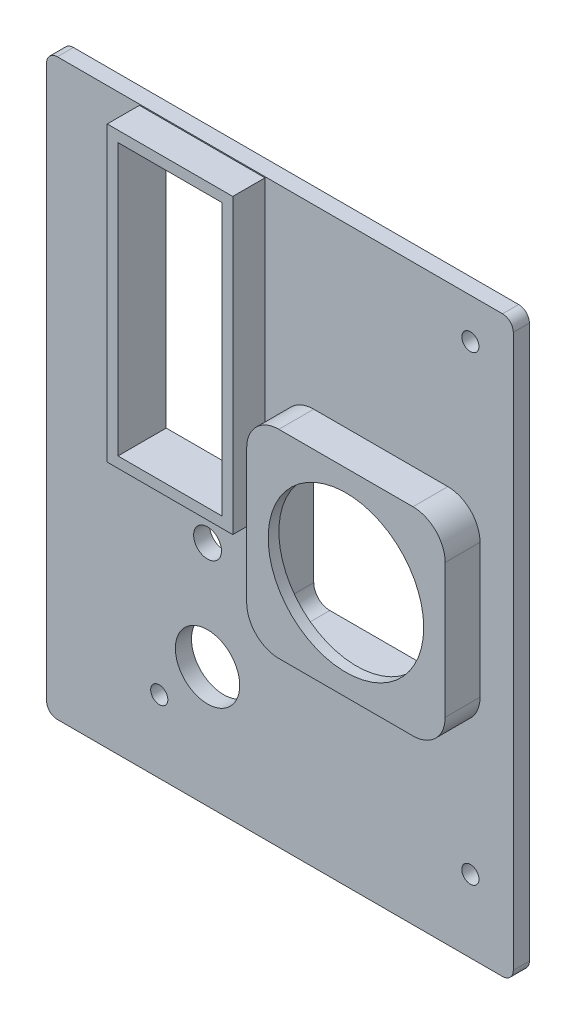
from build123d import *

# Parameters (mm, degrees)
IZIM1_W                 = 87
IZIM1_H                 = 107
TAPA_DEPTH              = 3
REDONDEO1_R             = 2
IZIM3_R                 = 1.6
HUECOSPLACA_DEPTH       = 3
IZIM2_R                 = 1.6
HUECODISIPADOR_DEPTH    = 3
HUECOFAN_DEPTH          = 10
SALIENTE_EXTRUIR4_START = 4.5
SALIENTE_EXTRUIR4_DEPTH = 4.5
SALIENTE_EXTRUIR5_START = -3
CROQUIS8_W              = 37.30700553
CROQUIS8_H              = 38.753013496
SALIENTE_EXTRUIR5_DEPTH = 3
SALIENTE_EXTRUIR6_START = 2
CROQUIS9_R              = 14.5
SALIENTE_EXTRUIR6_DEPTH = 2
CROQUIS10_R             = 2.6
CROQUIS10_R_2           = 6
LEDANDBUZZER_DEPTH      = 10
CROQUIS11_W             = 19.4
CROQUIS11_H             = 50.6
DISPLAY_DEPTH           = 10
CROQUIS12_W             = 23.4
CROQUIS12_H             = 54.6
CROQUIS12_W_2           = 19.4
CROQUIS12_H_2           = 50.6
SALIENTE_EXTRUIR7_DEPTH = 6


with BuildPart() as part:
    # Çizim1 → Tapa (new body)
    with BuildSketch(Plane.XY):
        Rectangle(IZIM1_W, IZIM1_H)
    extrude(amount=TAPA_DEPTH)

    # Redondeo1
    redondeo1_edges = [part.edges().sort_by_distance(p)[0] for p in [
        (43.5, -53.5, 1.5),
        (-43.5, -53.5, 1.5),
        (-43.5, 53.5, 1.5),
        (43.5, 53.5, 1.5),
    ]]
    fillet(redondeo1_edges, radius=REDONDEO1_R)

    # Çizim3 → HuecosPlaca (cut)
    with BuildSketch(Plane.XY.offset(3)):
        with Locations((35.5, 46)):
            Circle(IZIM3_R)
        with Locations((35.5, -40)):
            Circle(IZIM3_R)
        with Locations(Location((-22.5, 46, 0), (0, 0, 180))):
            Circle(IZIM3_R)
        with Locations(Location((-22.5, -40, 0), (0, 0, 180))):
            Circle(IZIM3_R)
    extrude(amount=-HUECOSPLACA_DEPTH, mode=Mode.SUBTRACT)

    # Çizim2 → HuecoDisipador (cut)
    with BuildSketch(Plane.XY.offset(3)):
        with Locations((34.8, 18)):
            Circle(IZIM2_R)
        with Locations((34.8, -14)):
            Circle(IZIM2_R)
        with Locations(Location((2.8, -14, 0), (0, 0, 180))):
            Circle(IZIM2_R)
        with Locations(Location((2.8, 18, 0), (0, 0, 180))):
            Circle(IZIM2_R)
    extrude(amount=-HUECODISIPADOR_DEPTH, mode=Mode.SUBTRACT)

    # Croquis1 → HuecoFan (cut)
    with BuildSketch(Plane.XY.offset(3)):
        with BuildLine():
            Line((6.3, -13.5), (31.3, -13.5))
            ThreePointArc((31.3, -13.5), (33.421320344, -12.621320344), (34.3, -10.5))
            Line((34.3, -10.5), (34.3, 14.5))
            ThreePointArc((34.3, 14.5), (33.421320344, 16.621320344), (31.3, 17.5))
            Line((31.3, 17.5), (6.3, 17.5))
            ThreePointArc((6.3, 17.5), (4.178679656, 16.621320344), (3.3, 14.5))
            Line((3.3, 14.5), (3.3, -10.5))
            ThreePointArc((3.3, -10.5), (4.178679656, -12.621320344), (6.3, -13.5))
        make_face()
    extrude(amount=-HUECOFAN_DEPTH, mode=Mode.SUBTRACT)

    # Croquis7 → Saliente-Extruir4 (add)
    with BuildSketch(Plane.XY.offset(3).offset(SALIENTE_EXTRUIR4_START)):
        with BuildLine():
            Line((6.3, -16.5), (31.3, -16.5))
            ThreePointArc((31.3, -16.5), (35.542640687, -14.742640687), (37.3, -10.5))
            Line((37.3, -10.5), (37.3, 14.5))
            ThreePointArc((37.3, 14.5), (35.542640687, 18.742640687), (31.3, 20.5))
            Line((31.3, 20.5), (6.3, 20.5))
            ThreePointArc((6.3, 20.5), (2.057359313, 18.742640687), (0.3, 14.5))
            Line((0.3, 14.5), (0.3, -10.5))
            ThreePointArc((0.3, -10.5), (2.057359313, -14.742640687), (6.3, -16.5))
        make_face()
        with BuildLine():
            Line((6.3, -13.5), (31.3, -13.5))
            ThreePointArc((31.3, -13.5), (33.421320344, -12.621320344), (34.3, -10.5))
            Line((34.3, -10.5), (34.3, 14.5))
            ThreePointArc((34.3, 14.5), (33.421320344, 16.621320344), (31.3, 17.5))
            Line((31.3, 17.5), (6.3, 17.5))
            ThreePointArc((6.3, 17.5), (4.178679656, 16.621320344), (3.3, 14.5))
            Line((3.3, 14.5), (3.3, -10.5))
            ThreePointArc((3.3, -10.5), (4.178679656, -12.621320344), (6.3, -13.5))
        make_face(mode=Mode.SUBTRACT)
    extrude(amount=-SALIENTE_EXTRUIR4_DEPTH)

    # Croquis8 → Saliente-Extruir5 (add)
    with BuildSketch(Plane(origin=(0, 0, 0), x_dir=(-1, 0, 0), z_dir=(0, 0, -1)).offset(SALIENTE_EXTRUIR5_START)):
        with Locations((-18.653502765, 2.530513941)):
            Rectangle(CROQUIS8_W, CROQUIS8_H)
        with BuildLine():
            Line((-3.3, -10.5), (-3.3, 14.5))
            ThreePointArc((-3.3, 14.5), (-4.178679656, 16.621320344), (-6.3, 17.5))
            Line((-6.3, 17.5), (-31.3, 17.5))
            ThreePointArc((-31.3, 17.5), (-33.421320344, 16.621320344), (-34.3, 14.5))
            Line((-34.3, 14.5), (-34.3, -10.5))
            ThreePointArc((-34.3, -10.5), (-33.421320344, -12.621320344), (-31.3, -13.5))
            Line((-31.3, -13.5), (-6.3, -13.5))
            ThreePointArc((-6.3, -13.5), (-4.178679656, -12.621320344), (-3.3, -10.5))
        make_face(mode=Mode.SUBTRACT)
    extrude(amount=SALIENTE_EXTRUIR5_DEPTH)

    # Croquis9 → Saliente-Extruir6 (add)
    with BuildSketch(Plane.XY.offset(7.5).offset(SALIENTE_EXTRUIR6_START)):
        with BuildLine():
            Line((6.3, -16.5), (31.3, -16.5))
            ThreePointArc((31.3, -16.5), (35.542640687, -14.742640687), (37.3, -10.5))
            Line((37.3, -10.5), (37.3, 14.5))
            ThreePointArc((37.3, 14.5), (35.542640687, 18.742640687), (31.3, 20.5))
            Line((31.3, 20.5), (6.3, 20.5))
            ThreePointArc((6.3, 20.5), (2.057359313, 18.742640687), (0.3, 14.5))
            Line((0.3, 14.5), (0.3, -10.5))
            ThreePointArc((0.3, -10.5), (2.057359313, -14.742640687), (6.3, -16.5))
        make_face()
        with Locations((18.8, 2)):
            Circle(CROQUIS9_R, mode=Mode.SUBTRACT)
    extrude(amount=-SALIENTE_EXTRUIR6_DEPTH)

    # Croquis10 → LEDandBUZZER (cut)
    with BuildSketch(Plane.XY.offset(3)):
        with Locations((-13.5, -11)):
            Circle(CROQUIS10_R)
        with Locations((-13.5, -31)):
            Circle(CROQUIS10_R_2)
    extrude(amount=-LEDANDBUZZER_DEPTH, mode=Mode.SUBTRACT)

    # Croquis11 → DISPLAY (cut)
    with BuildSketch(Plane.XY.offset(3)):
        with Locations((-14.5, 26)):
            Rectangle(CROQUIS11_W, CROQUIS11_H)
    extrude(amount=-DISPLAY_DEPTH, mode=Mode.SUBTRACT)

    # Croquis12 → Saliente-Extruir7 (add)
    with BuildSketch(Plane.XY.offset(3)):
        with Locations((-14.5, 26)):
            Rectangle(CROQUIS12_W, CROQUIS12_H)
        with Locations((-14.5, 26)):
            Rectangle(CROQUIS12_W_2, CROQUIS12_H_2, mode=Mode.SUBTRACT)
    extrude(amount=SALIENTE_EXTRUIR7_DEPTH)


solid = part.part
